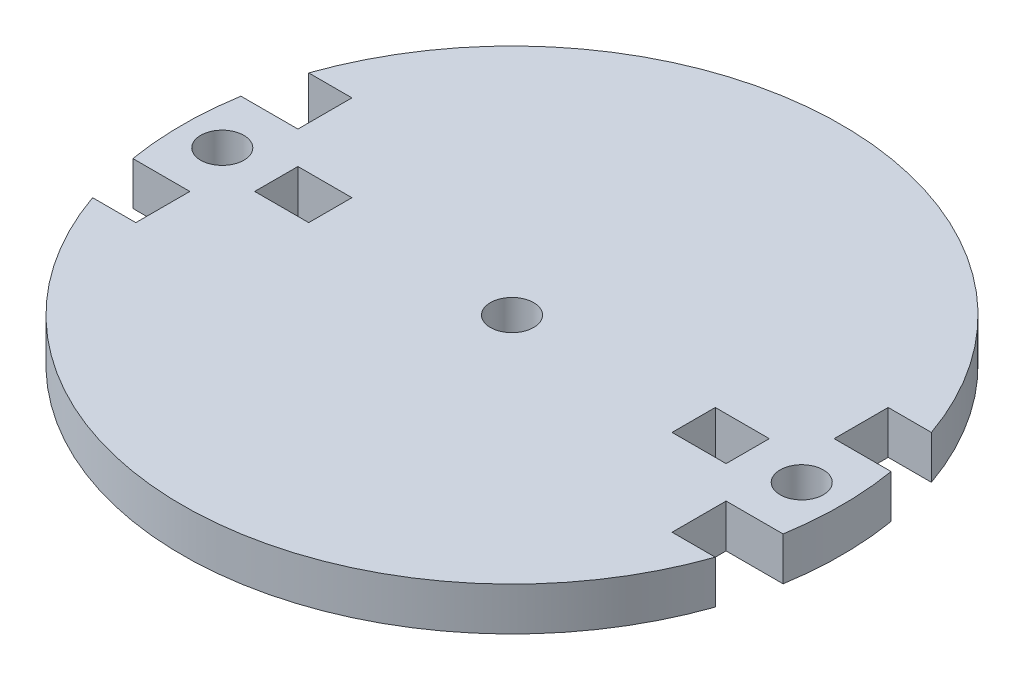
from build123d import *

# Parameters (mm, degrees)
CROQUIS1_R              = 30.5
SALIENTE_EXTRUIR1_DEPTH = 4
CROQUIS2_R              = 2
CORTAR_EXTRUIR1_DEPTH   = 4
CORTAR_EXTRUIR3_START   = -4
CORTAR_EXTRUIR3_DEPTH   = 4
CROQUIS6_W              = 5
CROQUIS6_H              = 4
CORTAR_EXTRUIR4_DEPTH   = 4
CROQUIS7_R              = 2
CORTAR_EXTRUIR5_DEPTH   = 4


with BuildPart() as part:
    # Croquis1 → Saliente-Extruir1 (new body)
    with BuildSketch(Plane(origin=(0, 0, 0), x_dir=(1, 0, 0), z_dir=(0, 1, 0))):
        with Locations(Location((0, 0, 0), (0, 0, 270))):
            Circle(CROQUIS1_R)
    extrude(amount=SALIENTE_EXTRUIR1_DEPTH)

    # Croquis2 → Cortar-Extruir1 (cut)
    with BuildSketch(Plane(origin=(0, 4, 0), x_dir=(1, 0, 0), z_dir=(0, 1, 0))):
        with Locations(Location((0, 0, 0), (0, 0, 270))):
            Circle(CROQUIS2_R)
    extrude(amount=-CORTAR_EXTRUIR1_DEPTH, mode=Mode.SUBTRACT)

    # Croquis5 → Cortar-Extruir3 (cut)
    with BuildSketch(Plane(origin=(0, 4, 0), x_dir=(1, 0, 0), z_dir=(0, 1, 0)).offset(CORTAR_EXTRUIR3_START)):
        with BuildLine():
            Line((28.814059068, 5), (30.087372767, 5))
            ThreePointArc((30.087372767, 5), (29.556634924, 7.526973624), (28.814059068, 10))
            Line((28.814059068, 10), (24.814059068, 10))
            Line((24.814059068, 10), (24.814059068, 5))
            Line((24.814059068, 5), (28.814059068, 5))
        make_face()
        with BuildLine():
            Line((30.087372767, -5), (28.814059068, -5))
            Line((28.814059068, -5), (24.814059068, -5))
            Line((24.814059068, -5), (24.814059068, -10))
            Line((24.814059068, -10), (28.814059068, -10))
            ThreePointArc((28.814059068, -10), (29.556634924, -7.526973624), (30.087372767, -5))
        make_face()
        with BuildLine():
            Line((-24.814059068, 5), (-24.814059068, 10))
            Line((-24.814059068, 10), (-28.814059068, 10))
            ThreePointArc((-28.814059068, 10), (-29.556634924, 7.526973624), (-30.087372767, 5))
            Line((-30.087372767, 5), (-28.814059068, 5))
            Line((-28.814059068, 5), (-24.814059068, 5))
        make_face()
        with BuildLine():
            Line((-28.814059068, -10), (-24.814059068, -10))
            Line((-24.814059068, -10), (-24.814059068, -5))
            Line((-24.814059068, -5), (-28.814059068, -5))
            Line((-28.814059068, -5), (-30.087372767, -5))
            ThreePointArc((-30.087372767, -5), (-29.556634924, -7.526973624), (-28.814059068, -10))
        make_face()
    extrude(amount=CORTAR_EXTRUIR3_DEPTH, mode=Mode.SUBTRACT)

    # Croquis6 → Cortar-Extruir4 (cut)
    with BuildSketch(Plane(origin=(0, 4, 0), x_dir=(1, 0, 0), z_dir=(0, 1, 0))):
        with Locations((-19.314059068, 0)):
            Rectangle(CROQUIS6_W, CROQUIS6_H)
        with Locations((19.314059068, 0)):
            Rectangle(CROQUIS6_W, CROQUIS6_H)
    extrude(amount=-CORTAR_EXTRUIR4_DEPTH, mode=Mode.SUBTRACT)

    # Croquis7 → Cortar-Extruir5 (cut)
    with BuildSketch(Plane(origin=(0, 4, 0), x_dir=(1, 0, 0), z_dir=(0, 1, 0))):
        with Locations(Location((-26.814059068, 0, 0), (0, 0, 270))):
            Circle(CROQUIS7_R)
        with Locations(Location((26.814059068, 0, 0), (0, 0, 90))):
            Circle(CROQUIS7_R)
    extrude(amount=-CORTAR_EXTRUIR5_DEPTH, mode=Mode.SUBTRACT)


solid = part.part
